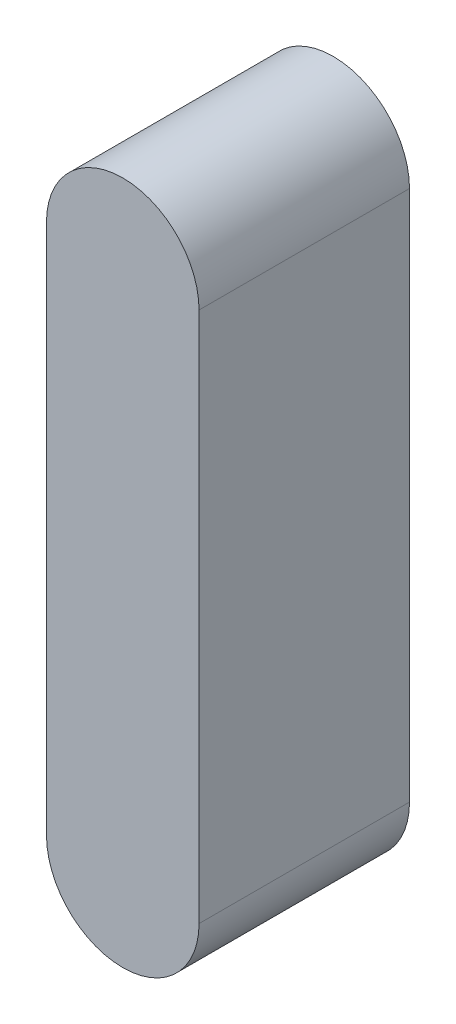
from build123d import *

# Parameters (mm, degrees)
BOSS_EXTRUDE1_DEPTH = 4


with BuildPart() as part:
    # Sketch1 → Boss-Extrude1 (new body)
    with BuildSketch(Plane.XY):
        with BuildLine():
            Line((0, 6.5), (0, -6.5))
            ThreePointArc((0, -6.5), (1.025304833, -6.075304833), (1.45, -5.05))
            Line((1.45, -5.05), (1.45, 5.05))
            ThreePointArc((1.45, 5.05), (1.025304833, 6.075304833), (0, 6.5))
        make_face()
        with BuildLine():
            Line((-1.45, 5.05), (-1.45, -5.05))
            ThreePointArc((-1.45, -5.05), (-1.025304833, -6.075304833), (0, -6.5))
            Line((0, -6.5), (0, 6.5))
            ThreePointArc((0, 6.5), (-1.025304833, 6.075304833), (-1.45, 5.05))
        make_face()
    extrude(amount=BOSS_EXTRUDE1_DEPTH)


solid = part.part
